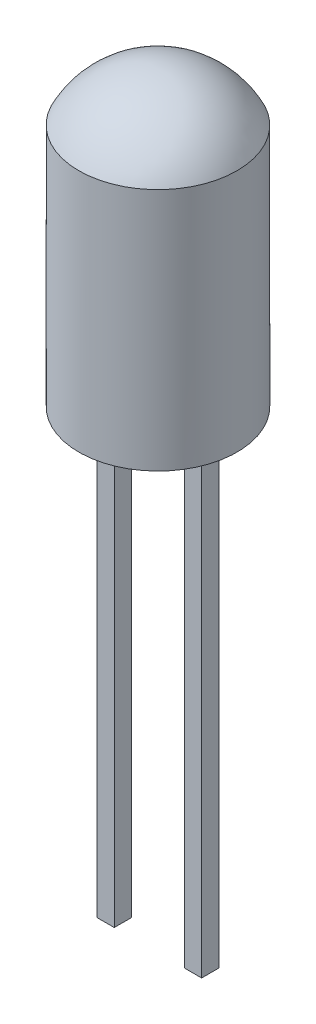
from build123d import *

# Parameters (mm, degrees)
CROQUIS2_W              = 0.5
CROQUIS2_H              = 0.5
SALIENTE_EXTRUIR1_DEPTH = 13.5


with BuildPart() as part:
    # Croquis1 → Revolución1 (revolve)
    with BuildSketch(Plane.XY):
        with BuildLine():
            Line((0, 0), (2.299223692, 0))
            Line((2.299223692, 0), (2.299223692, 7.084178562))
            ThreePointArc((2.299223692, 7.084178562), (1.350090731, 8.117657033), (0, 8.5))
            Line((0, 8.5), (0, 0))
        make_face()
    revolve(axis=Axis((0, 8.5, 0), (0, -1, 0)))

    # Croquis2 → Saliente-Extruir1 (add)
    with BuildSketch(Plane.XZ):
        with Locations((1.27, 0)):
            Rectangle(CROQUIS2_W, CROQUIS2_H)
        with Locations((-1.27, 0)):
            Rectangle(CROQUIS2_W, CROQUIS2_H)
    extrude(amount=SALIENTE_EXTRUIR1_DEPTH)


solid = part.part
